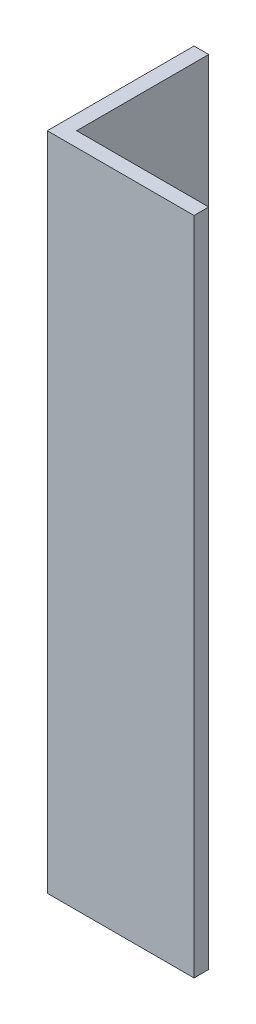
from build123d import *

# Parameters (mm, degrees)
BOSS_EXTRUDE1_DEPTH = 90


with BuildPart() as part:
    # Sketch1 → Boss-Extrude1 (new body)
    with BuildSketch(Plane(origin=(0, 0, 0), x_dir=(1, 0, 0), z_dir=(0, 1, 0))):
        Polygon((0, 0), (20, 0), (20, 2), (2, 2), (2, 20), (0, 20), align=None)
    extrude(amount=BOSS_EXTRUDE1_DEPTH)


solid = part.part
